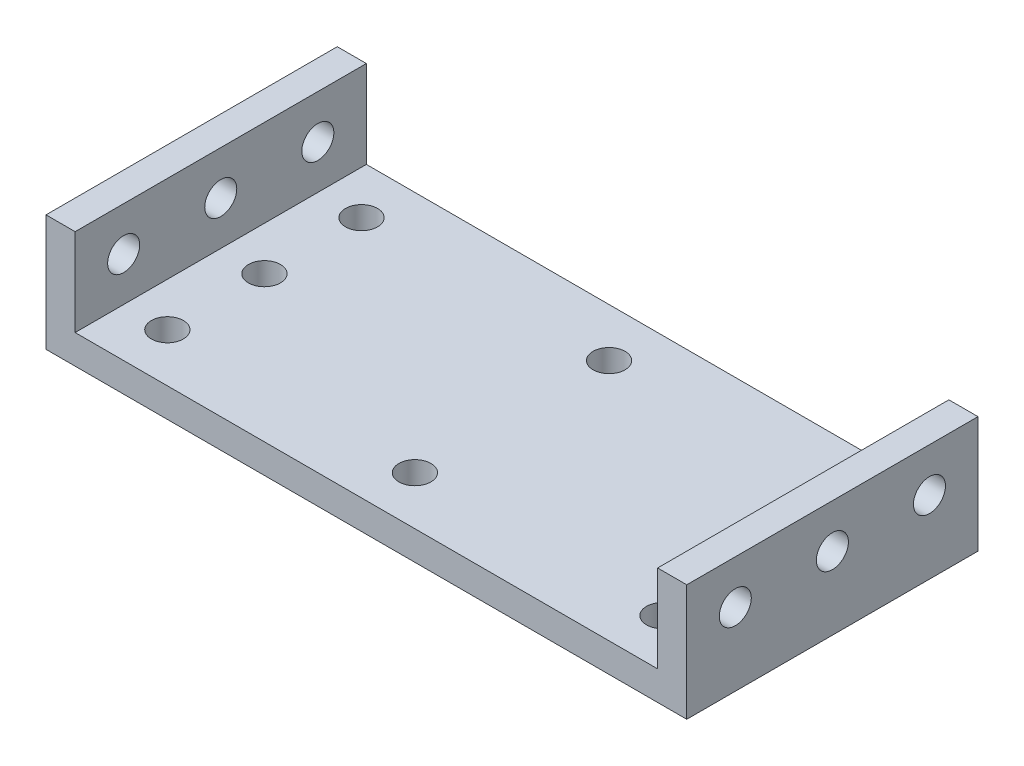
from build123d import *

# Parameters (mm, degrees)
EXTRUDE_1_DEPTH     = 30
SKETCH_2_R          = 1.65
CUT_EXTRUDE_1_DEPTH = 74.054773971
CUT_EXTRUDE_2_REACH = 72.356
SKETCH_3_R          = 1.65
CUT_EXTRUDE_3_REACH = 72.356
SKETCH_4_R          = 1.65


with BuildPart() as part:
    # ｽｹｯﾁ1 → ﾎﾞｽ - 押し出し1 (new body)
    with BuildSketch(Plane.XY):
        Polygon((0, 0), (0, 9), (-3, 9), (-3, -3), (63, -3), (63, 9), (60, 9), (60, 0), align=None)
    extrude(amount=EXTRUDE_1_DEPTH)

    # ｽｹｯﾁ2 → ｶｯﾄ - 押し出し1 (cut, through all)
    with BuildSketch(Plane(origin=(63, 0, 0), x_dir=(0, 0, -1), z_dir=(1, 0, 0))):
        with Locations((-25, 4.5)):
            Circle(SKETCH_2_R)
        with Locations((-5, 4.5)):
            Circle(SKETCH_2_R)
        with Locations((-15, 4.5)):
            Circle(SKETCH_2_R)
    extrude(amount=-CUT_EXTRUDE_1_DEPTH, mode=Mode.SUBTRACT)

    # ｽｹｯﾁ3 → ｶｯﾄ - 押し出し2 (cut, up to next)
    with BuildSketch(Plane(origin=(0, 0, 0), x_dir=(1, 0, 0), z_dir=(0, 1, 0)), mode=Mode.PRIVATE) as cut_extrude_2_sk1:
        with Locations(Location((30, -5, 0), (0, 0, 180))):
            Circle(SKETCH_3_R)
    cut_extrude_2_tool1 = extrude(cut_extrude_2_sk1.sketch, amount=-CUT_EXTRUDE_2_REACH, mode=Mode.PRIVATE) & part.part
    # ｽｹｯﾁ3 → ｶｯﾄ - 押し出し2 (cut, up to next)
    with BuildSketch(Plane(origin=(0, 0, 0), x_dir=(1, 0, 0), z_dir=(0, 1, 0)), mode=Mode.PRIVATE) as cut_extrude_2_sk2:
        with Locations(Location((30, -25, 0), (0, 0, 180))):
            Circle(SKETCH_3_R)
    cut_extrude_2_tool2 = extrude(cut_extrude_2_sk2.sketch, amount=-CUT_EXTRUDE_2_REACH, mode=Mode.PRIVATE) & part.part
    add(cut_extrude_2_tool1.solids().sort_by_distance((30, 0, 5))[0], mode=Mode.SUBTRACT)
    add(cut_extrude_2_tool2.solids().sort_by_distance((30, 0, 25))[0], mode=Mode.SUBTRACT)

    # ｽｹｯﾁ4 → ｶｯﾄ - 押し出し3 (cut, up to next)
    with BuildSketch(Plane(origin=(0, 0, 0), x_dir=(1, 0, 0), z_dir=(0, 1, 0)), mode=Mode.PRIVATE) as cut_extrude_3_sk1:
        with Locations(Location((4.5, -5, 0), (0, 0, 180))):
            Circle(SKETCH_4_R)
    cut_extrude_3_tool1 = extrude(cut_extrude_3_sk1.sketch, amount=-CUT_EXTRUDE_3_REACH, mode=Mode.PRIVATE) & part.part
    # ｽｹｯﾁ4 → ｶｯﾄ - 押し出し3 (cut, up to next)
    with BuildSketch(Plane(origin=(0, 0, 0), x_dir=(1, 0, 0), z_dir=(0, 1, 0)), mode=Mode.PRIVATE) as cut_extrude_3_sk2:
        with Locations(Location((4.5, -15, 0), (0, 0, 180))):
            Circle(SKETCH_4_R)
    cut_extrude_3_tool2 = extrude(cut_extrude_3_sk2.sketch, amount=-CUT_EXTRUDE_3_REACH, mode=Mode.PRIVATE) & part.part
    # ｽｹｯﾁ4 → ｶｯﾄ - 押し出し3 (cut, up to next)
    with BuildSketch(Plane(origin=(0, 0, 0), x_dir=(1, 0, 0), z_dir=(0, 1, 0)), mode=Mode.PRIVATE) as cut_extrude_3_sk3:
        with Locations(Location((4.5, -25, 0), (0, 0, 180))):
            Circle(SKETCH_4_R)
    cut_extrude_3_tool3 = extrude(cut_extrude_3_sk3.sketch, amount=-CUT_EXTRUDE_3_REACH, mode=Mode.PRIVATE) & part.part
    # ｽｹｯﾁ4 → ｶｯﾄ - 押し出し3 (cut, up to next)
    with BuildSketch(Plane(origin=(0, 0, 0), x_dir=(1, 0, 0), z_dir=(0, 1, 0)), mode=Mode.PRIVATE) as cut_extrude_3_sk4:
        with Locations(Location((55.5, -25, 0), (0, 0, 180))):
            Circle(SKETCH_4_R)
    cut_extrude_3_tool4 = extrude(cut_extrude_3_sk4.sketch, amount=-CUT_EXTRUDE_3_REACH, mode=Mode.PRIVATE) & part.part
    # ｽｹｯﾁ4 → ｶｯﾄ - 押し出し3 (cut, up to next)
    with BuildSketch(Plane(origin=(0, 0, 0), x_dir=(1, 0, 0), z_dir=(0, 1, 0)), mode=Mode.PRIVATE) as cut_extrude_3_sk5:
        with Locations(Location((55.5, -15, 0), (0, 0, 180))):
            Circle(SKETCH_4_R)
    cut_extrude_3_tool5 = extrude(cut_extrude_3_sk5.sketch, amount=-CUT_EXTRUDE_3_REACH, mode=Mode.PRIVATE) & part.part
    # ｽｹｯﾁ4 → ｶｯﾄ - 押し出し3 (cut, up to next)
    with BuildSketch(Plane(origin=(0, 0, 0), x_dir=(1, 0, 0), z_dir=(0, 1, 0)), mode=Mode.PRIVATE) as cut_extrude_3_sk6:
        with Locations(Location((55.5, -5, 0), (0, 0, 180))):
            Circle(SKETCH_4_R)
    cut_extrude_3_tool6 = extrude(cut_extrude_3_sk6.sketch, amount=-CUT_EXTRUDE_3_REACH, mode=Mode.PRIVATE) & part.part
    add(cut_extrude_3_tool1.solids().sort_by_distance((4.5, 0, 5))[0], mode=Mode.SUBTRACT)
    add(cut_extrude_3_tool2.solids().sort_by_distance((4.5, 0, 15))[0], mode=Mode.SUBTRACT)
    add(cut_extrude_3_tool3.solids().sort_by_distance((4.5, 0, 25))[0], mode=Mode.SUBTRACT)
    add(cut_extrude_3_tool4.solids().sort_by_distance((55.5, 0, 25))[0], mode=Mode.SUBTRACT)
    add(cut_extrude_3_tool5.solids().sort_by_distance((55.5, 0, 15))[0], mode=Mode.SUBTRACT)
    add(cut_extrude_3_tool6.solids().sort_by_distance((55.5, 0, 5))[0], mode=Mode.SUBTRACT)


solid = part.part
